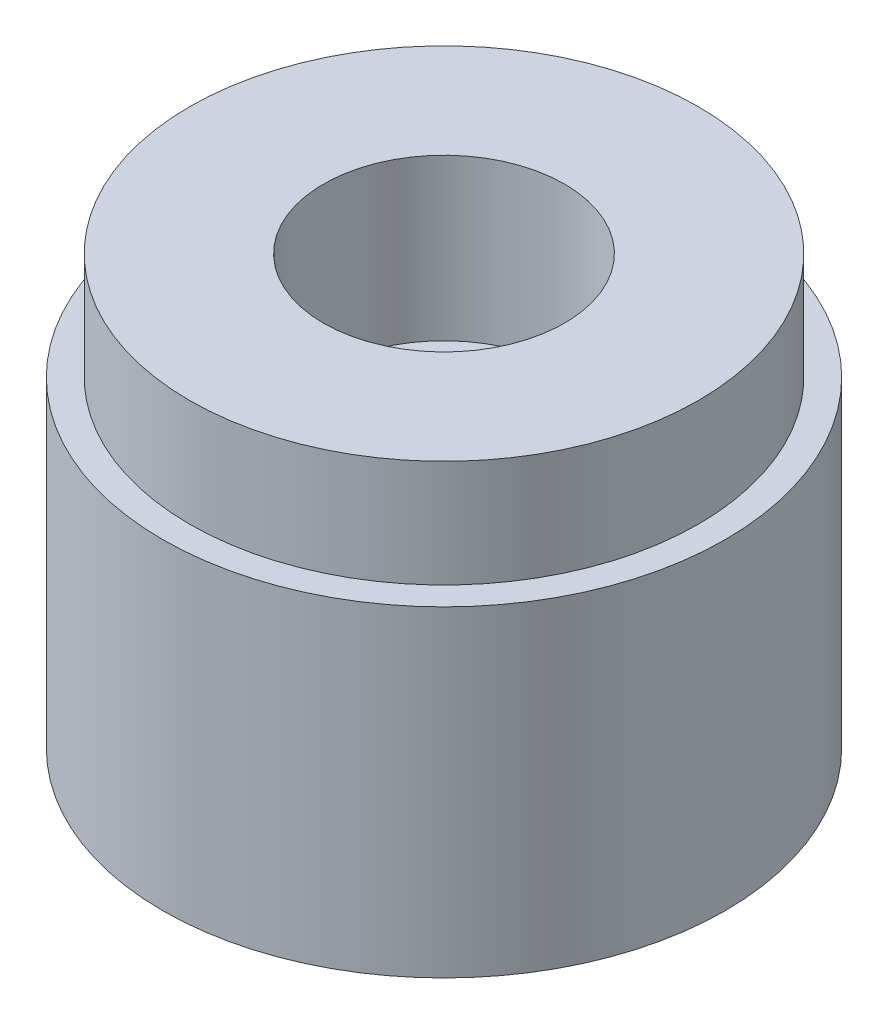
from build123d import *

# Parameters (mm, degrees)
ESQUISSE2_R             = 2.25
ENL_V_MAT_EXTRU_1_DEPTH = 3


with BuildPart() as part:
    # Esquisse1 → Révolution1 (revolve)
    with BuildSketch(Plane.XY, mode=Mode.PRIVATE) as r_volution1_sk:
        Polygon((1.35, 0), (1.35, 8), (4.75, 8), (4.75, 6), (5.25, 6), (5.25, 0), align=None)
    revolve(r_volution1_sk.sketch.rotate(Axis((0, 0, 0), (0, 1, 0)), 90), axis=Axis((0, 0, 0), (0, 1, 0)))

    # Esquisse2 → Enlèv. mat.-Extru.1 (cut)
    with BuildSketch(Plane(origin=(0, 8, 0), x_dir=(1, 0, 0), z_dir=(0, 1, 0))):
        with Locations(Location((0, 0, 0), (0, 0, 270))):
            Circle(ESQUISSE2_R)
    extrude(amount=-ENL_V_MAT_EXTRU_1_DEPTH, mode=Mode.SUBTRACT)


solid = part.part
